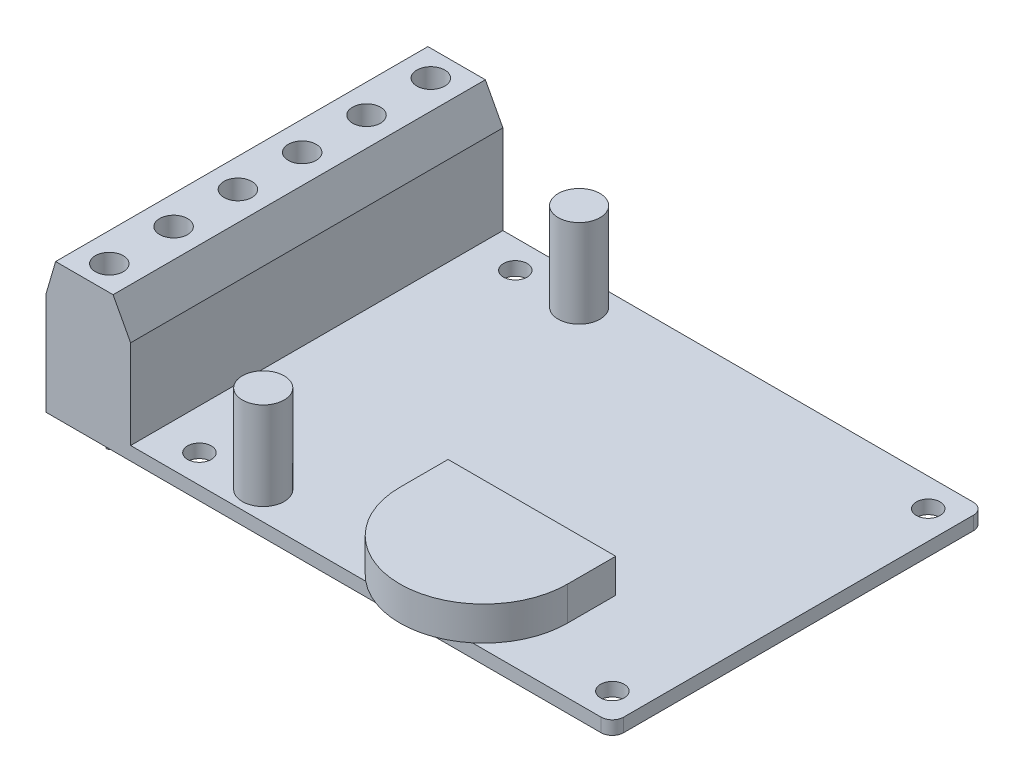
from build123d import *

# Parameters (mm, degrees)
EXTRUDE_1_DEPTH     = 1.2
EXTRUDE_3_DEPTH     = 33
SKETCH_4_R          = 1.237994263
CUT_EXTRUDE_1_DEPTH = 2
SKETCH_5_R          = 1.05
CUT_EXTRUDE_2_DEPTH = 2
SKETCH_6_R          = 0.435075244
EXTRUDE_4_DEPTH     = 0.1
SKETCH_7_R          = 0.221451087
EXTRUDE_5_DEPTH     = 2
SKETCH_8_W          = 0.314102564
SKETCH_8_H          = 2.557692308
EXTRUDE_6_DEPTH     = 0.01
EXTRUDE_8_DEPTH     = 3
SKETCH_10_R         = 1.85458941
EXTRUDE_7_DEPTH     = 7.8


with BuildPart() as part:
    # 草图2 → 凸台-拉伸1 (new body)
    with BuildSketch(Plane(origin=(0, 0, 0), x_dir=(1, 0, 0), z_dir=(0, 1, 0))):
        with BuildLine():
            Line((1, 0), (49.2, 0))
            ThreePointArc((49.2, 0), (49.907106781, -0.292893219), (50.2, -1))
            Line((50.2, -1), (50.2, -32))
            ThreePointArc((50.2, -32), (49.907106781, -32.707106781), (49.2, -33))
            Line((49.2, -33), (1, -33))
            ThreePointArc((1, -33), (0.292893219, -32.707106781), (0, -32))
            Line((0, -32), (0, -1))
            ThreePointArc((0, -1), (0.292893219, -0.292893219), (1, 0))
        make_face()
    extrude(amount=EXTRUDE_1_DEPTH)

    # 草图5 → 切除-拉伸2 (cut)
    with BuildSketch(Plane(origin=(0, 1.2, 0), x_dir=(1, 0, 0), z_dir=(0, 1, 0))):
        with Locations(Location((47.7, -2.5, 0), (0, 0, 270))):
            Circle(SKETCH_5_R)
        with Locations(Location((47.7, -30.5, 0), (0, 0, 270))):
            Circle(SKETCH_5_R)
        with Locations(Location((11.1, -2.5, 0), (0, 0, 270))):
            Circle(SKETCH_5_R)
        with Locations(Location((11.1, -30.5, 0), (0, 0, 270))):
            Circle(SKETCH_5_R)
    extrude(amount=-CUT_EXTRUDE_2_DEPTH, mode=Mode.SUBTRACT)



with BuildPart() as body_2:
    # 草图3 → 凸台-拉伸3 (new body)
    with BuildSketch(Plane.XY):
        Polygon((0, 0), (0, 9.08434782), (0.851677453, 12), (5.945874068, 12), (7.5, 9.08434782), (7.5, 0), align=None)
    extrude(amount=EXTRUDE_3_DEPTH)

    # 草图4 → 切除-拉伸1 (cut)
    with BuildSketch(Plane(origin=(0, 12, 0), x_dir=(1, 0, 0), z_dir=(0, 1, 0))):
        with Locations(Location((3.39877576, -2.288422337, 0), (0, 0, 270))):
            Circle(SKETCH_4_R)
        with Locations(Location((3.39877576, -7.988422337, 0), (0, 0, 270))):
            Circle(SKETCH_4_R)
        with Locations(Location((3.39877576, -13.688422337, 0), (0, 0, 270))):
            Circle(SKETCH_4_R)
        with Locations(Location((3.39877576, -19.388422337, 0), (0, 0, 270))):
            Circle(SKETCH_4_R)
        with Locations(Location((3.39877576, -25.088422337, 0), (0, 0, 270))):
            Circle(SKETCH_4_R)
        with Locations(Location((3.39877576, -30.788422337, 0), (0, 0, 270))):
            Circle(SKETCH_4_R)
    extrude(amount=-CUT_EXTRUDE_1_DEPTH, mode=Mode.SUBTRACT)


with BuildPart() as part_1:
    add(part.part)

    add(body_2.part)  # 凸台-拉伸4 merges body 2
    # 草图6 → 凸台-拉伸4 (add)
    with BuildSketch(Plane.XZ):
        with Locations(Location((3.39877576, 25.088422337, 0), (0, 0, 90))):
            Circle(SKETCH_6_R)
        with Locations(Location((3.39877576, 19.388422337, 0), (0, 0, 90))):
            Circle(SKETCH_6_R)
        with Locations(Location((3.39877576, 13.688422337, 0), (0, 0, 90))):
            Circle(SKETCH_6_R)
        with Locations(Location((3.39877576, 7.988422337, 0), (0, 0, 90))):
            Circle(SKETCH_6_R)
        with Locations(Location((3.39877576, 2.288422337, 0), (0, 0, 90))):
            Circle(SKETCH_6_R)
        with Locations(Location((3.39877576, 30.788422337, 0), (0, 0, 90))):
            Circle(SKETCH_6_R)
    extrude(amount=EXTRUDE_4_DEPTH)

    # 草图7 → 凸台-拉伸5 (add)
    with BuildSketch(Plane.XZ.offset(0.1)):
        with Locations(Location((3.39877576, 30.788422337, 0), (0, 0, 270))):
            Circle(SKETCH_7_R)
        with Locations(Location((3.39877576, 25.088422337, 0), (0, 0, 270))):
            Circle(SKETCH_7_R)
        with Locations(Location((3.39877576, 19.388422337, 0), (0, 0, 270))):
            Circle(SKETCH_7_R)
        with Locations(Location((3.39877576, 13.688422337, 0), (0, 0, 270))):
            Circle(SKETCH_7_R)
        with Locations(Location((3.39877576, 7.988422337, 0), (0, 0, 270))):
            Circle(SKETCH_7_R)
        with Locations(Location((3.39877576, 2.288422337, 0), (0, 0, 270))):
            Circle(SKETCH_7_R)
    extrude(amount=EXTRUDE_5_DEPTH)

    # 草图8 → 凸台-拉伸6 (add)
    # profile 1 of 6: a face of its own
    with BuildSketch(Plane.XZ):
        with BuildLine():
            Line((18.513026826, 20), (19.213447499, 20))
            add(Edge.make_bspline(
                [(19.213447499, 20), (19.260188628, 19.999844414), (19.349936772, 19.999545672), (19.478510043, 19.997879909), (19.59533714, 19.993105553), (19.700356979, 19.98899697), (19.793567634, 19.981505028), (19.875254925, 19.974344381), (19.945042622, 19.96497072), (19.987288473, 19.956265297), (20.006416249, 19.952323718)],
                knots=[0, 0, 0, 0, 1.410062039, 2.707475311, 3.878576406, 4.937260626, 5.877586885, 6.699081471, 7.410979367, 8, 8, 8, 8], degree=3))
            add(Edge.make_bspline(
                [(20.006416249, 19.952323718), (20.032022873, 19.945996953), (20.082689863, 19.933478389), (20.155639929, 19.907018788), (20.225154253, 19.876399163), (20.290944077, 19.840435443), (20.352679868, 19.798860663), (20.410998179, 19.752392541), (20.466163643, 19.701285335), (20.515945273, 19.644250494), (20.562884324, 19.584413984), (20.602472951, 19.519710227), (20.636599431, 19.4520487), (20.663769948, 19.380741282), (20.685647921, 19.30647951), (20.701074161, 19.228590713), (20.710325348, 19.147429738), (20.711267204, 19.09207183), (20.711744775, 19.064002404)],
                knots=[0, 0, 0, 0, 1.027469482, 2.033020251, 3.019912614, 3.986113645, 4.951240523, 5.91722682, 6.890402269, 7.87763091, 8.8651537, 9.85103654, 10.82876324, 11.815024772, 12.821070561, 13.842952187, 14.906261191, 16, 16, 16, 16], degree=3))
            add(Edge.make_bspline(
                [(20.711744775, 19.064002404), (20.710275777, 19.017367299), (20.707409381, 18.926370131), (20.680684277, 18.79430925), (20.636907758, 18.671119935), (20.576584469, 18.556957297), (20.499764993, 18.454046652), (20.407440202, 18.363656197), (20.29955859, 18.288016284), (20.199129274, 18.235563479), (20.110415075, 18.201970571), (20.037381762, 18.178334212), (19.957714784, 18.160072247), (19.87217745, 18.143712115), (19.780413794, 18.13136042), (19.682643755, 18.122313826), (19.578797603, 18.116659777), (19.507458534, 18.115817772), (19.470759198, 18.115384615)],
                knots=[0, 0, 0, 0, 1.260483769, 2.459530307, 3.627416485, 4.787058657, 5.939039949, 7.08810263, 8.267026773, 9.491475466, 10.141966685, 10.831826277, 11.566392101, 12.351337768, 13.187381173, 14.07005841, 15.007169909, 16, 16, 16, 16], degree=3))
            Line((19.470759198, 18.115384615), (20.75661657, 16.5))
            Line((20.75661657, 16.5), (20.368195095, 16.5))
            Line((20.368195095, 16.5), (19.082337724, 18.115384615))
            Line((19.082337724, 18.115384615), (18.82712939, 18.115384615))
            Line((18.82712939, 18.115384615), (18.82712939, 16.5))
            Line((18.82712939, 16.5), (18.513026826, 16.5))
            Line((18.513026826, 16.5), (18.513026826, 20))
        make_face()
        with BuildLine():
            Line((18.82712939, 19.641025641), (18.82712939, 18.474358974))
            Line((18.82712939, 18.474358974), (19.467954711, 18.469451122))
            add(Edge.make_bspline(
                [(19.467954711, 18.469451122), (19.49787475, 18.469437885), (19.555868307, 18.469412229), (19.639768972, 18.473406005), (19.717889083, 18.477949323), (19.789929836, 18.484898669), (19.855923411, 18.49385474), (19.915836824, 18.505057725), (19.969767876, 18.518109787), (20.032666414, 18.538311413), (20.102902946, 18.570317431), (20.179234406, 18.61688293), (20.244236743, 18.675452049), (20.299154606, 18.742425505), (20.343284037, 18.816061754), (20.374396092, 18.895478123), (20.394138534, 18.978669721), (20.396467079, 19.035847829), (20.397642211, 19.064703526)],
                knots=[0, 0, 0, 0, 1.146690395, 2.22261258, 3.21895312, 4.145990853, 4.996080663, 5.770904154, 6.481378293, 7.121626537, 8.300444488, 9.431385265, 10.535395872, 11.636531494, 12.74115979, 13.810798291, 14.895190096, 16, 16, 16, 16], degree=3))
            add(Edge.make_bspline(
                [(20.397642211, 19.064703526), (20.39644009, 19.092850099), (20.394057924, 19.148626338), (20.374609156, 19.230282248), (20.341719775, 19.307349198), (20.297397537, 19.379513683), (20.243398382, 19.445019419), (20.180080569, 19.501066572), (20.109175374, 19.547316037), (20.042904175, 19.576870418), (19.983669963, 19.594990271), (19.932240303, 19.607741435), (19.874128825, 19.617985904), (19.809053367, 19.626193964), (19.737291736, 19.633248909), (19.658481085, 19.638000687), (19.573144304, 19.640814551), (19.513997373, 19.64095364), (19.48337939, 19.641025641)],
                knots=[0, 0, 0, 0, 1.101028733, 2.181837193, 3.264309656, 4.369019818, 5.486613113, 6.575447106, 7.666700264, 8.788928104, 9.402425223, 10.0903467, 10.862060571, 11.710948788, 12.657782767, 13.684531032, 14.801375019, 16, 16, 16, 16], degree=3))
            Line((19.48337939, 19.641025641), (18.82712939, 19.641025641))
        make_face(mode=Mode.SUBTRACT)
    # profile 2 of 6: a face of its own
    with BuildSketch(Plane.XZ):
        with BuildLine():
            Line((21.339949903, 19.057692308), (21.654052467, 19.057692308))
            Line((21.654052467, 19.057692308), (21.654052467, 17.871394231))
            add(Edge.make_bspline(
                [(21.654052467, 17.871394231), (21.654194372, 17.836571482), (21.65446583, 17.769957194), (21.656306771, 17.674102007), (21.660636864, 17.586685294), (21.666050689, 17.507656557), (21.673012825, 17.437029166), (21.681296185, 17.375049809), (21.690554607, 17.321015625), (21.699617321, 17.288472269), (21.703832115, 17.27333734)],
                knots=[0, 0, 0, 0, 1.388932606, 2.656963016, 3.823490214, 4.879454478, 5.816252168, 6.653371382, 7.373723809, 8, 8, 8, 8], degree=3))
            add(Edge.make_bspline(
                [(21.703832115, 17.27333734), (21.71059357, 17.254314469), (21.723975911, 17.216664208), (21.748249395, 17.162275202), (21.778277731, 17.11189992), (21.811137559, 17.063595847), (21.849036967, 17.01879386), (21.891496438, 16.977569617), (21.937094675, 16.938365526), (22.004849698, 16.891980734), (22.097508964, 16.842265403), (22.219161719, 16.799369585), (22.351065945, 16.773733765), (22.442230665, 16.77075951), (22.489088525, 16.769230769)],
                knots=[0, 0, 0, 0, 0.725840625, 1.436591201, 2.137033971, 2.831655856, 3.53531722, 4.242432219, 4.957935707, 5.694543706, 7.190802206, 8.724350549, 10.316345118, 12, 12, 12, 12], degree=3))
            add(Edge.make_bspline(
                [(22.489088525, 16.769230769), (22.535942033, 16.770792018), (22.626594901, 16.773812745), (22.75704987, 16.798596284), (22.876301285, 16.840001973), (22.983152236, 16.897809384), (23.077118076, 16.968551447), (23.155422495, 17.051560256), (23.220029749, 17.144209643), (23.24823917, 17.213333922), (23.262425865, 17.248096955)],
                knots=[0, 0, 0, 0, 1.157059328, 2.238695713, 3.266970494, 4.264342957, 5.228770407, 6.160125903, 7.074715775, 8, 8, 8, 8], degree=3))
            add(Edge.make_bspline(
                [(23.262425865, 17.248096955), (23.266620095, 17.262063254), (23.275892513, 17.292939329), (23.285854865, 17.345319078), (23.294829326, 17.407783682), (23.302492502, 17.480741891), (23.307957665, 17.564003043), (23.310903692, 17.657541119), (23.314231967, 17.76106248), (23.314282483, 17.833530239), (23.314308878, 17.871394231)],
                knots=[0, 0, 0, 0, 0.557542046, 1.232589297, 2.036731608, 2.971723315, 4.038036528, 5.22795436, 6.551621927, 8, 8, 8, 8], degree=3))
            Line((23.314308878, 17.871394231), (23.314308878, 19.057692308))
            Line((23.314308878, 19.057692308), (23.628411442, 19.057692308))
            Line((23.628411442, 19.057692308), (23.628411442, 17.8125))
            add(Edge.make_bspline(
                [(23.628411442, 17.8125), (23.627969747, 17.770192829), (23.627112798, 17.688111129), (23.621605455, 17.568827017), (23.612155842, 17.457664772), (23.597813157, 17.354565552), (23.580947483, 17.259608071), (23.55919121, 17.172670625), (23.533212972, 17.094021071), (23.503907457, 17.022279294), (23.46928559, 16.9572324), (23.432458569, 16.895496583), (23.389933797, 16.838603648), (23.345163563, 16.783721511), (23.295361907, 16.733579983), (23.241462048, 16.687028507), (23.184222628, 16.643355476), (23.12237343, 16.604264196), (23.056817367, 16.569047551), (22.98747351, 16.537831473), (22.913492512, 16.513128896), (22.835828875, 16.49181823), (22.754102096, 16.475103761), (22.668390963, 16.463317194), (22.578724346, 16.456091863), (22.517614887, 16.455454818), (22.486284038, 16.455128205)],
                knots=[0, 0, 0, 0, 1.493040784, 2.896703357, 4.213163133, 5.428574705, 6.569057535, 7.615249723, 8.588095153, 9.490268104, 10.346124644, 11.18633936, 12.024365274, 12.850166724, 13.684164916, 14.514361689, 15.362232829, 16.222528818, 17.093394965, 17.986930858, 18.902426812, 19.842810585, 20.827885679, 21.843828298, 22.894529745, 24, 24, 24, 24], degree=3))
            add(Edge.make_bspline(
                [(22.486284038, 16.455128205), (22.455187524, 16.455467912), (22.394079979, 16.456135468), (22.304408734, 16.463277276), (22.218460128, 16.475085447), (22.13653973, 16.491940664), (22.058565332, 16.512979734), (21.984221092, 16.53798327), (21.914377529, 16.569063751), (21.848195525, 16.604041309), (21.786193137, 16.643606584), (21.728084559, 16.686974624), (21.673947707, 16.734080687), (21.623770639, 16.784728044), (21.578257662, 16.83954498), (21.53684162, 16.898090541), (21.498884915, 16.959784629), (21.464532125, 17.025847792), (21.435020369, 17.098419802), (21.408965123, 17.178716899), (21.387654485, 17.267619415), (21.370312017, 17.365051344), (21.356360576, 17.470546385), (21.346674434, 17.584714801), (21.341258603, 17.707278493), (21.340395542, 17.791928383), (21.339949903, 17.835637019)],
                knots=[0, 0, 0, 0, 1.083640291, 2.129454052, 3.13281866, 4.105697902, 5.042300162, 5.946461698, 6.836384745, 7.703652036, 8.553297018, 9.397182691, 10.228592656, 11.052265423, 11.879314572, 12.708807002, 13.549817954, 14.402308542, 15.300838682, 16.27712199, 17.341985831, 18.484375296, 19.725102775, 21.0496083, 22.476576903, 24, 24, 24, 24], degree=3))
            Line((21.339949903, 17.835637019), (21.339949903, 19.057692308))
        make_face()
    # profile 3 of 6: a face of its own
    with BuildSketch(Plane.XZ):
        with BuildLine():
            add(Edge.make_bspline(
                [(24.457137403, 20.134615385), (24.476628719, 20.133711232), (24.514796459, 20.131940728), (24.569989726, 20.116779251), (24.620246739, 20.091079566), (24.664824471, 20.056599885), (24.703076358, 20.016050441), (24.729857069, 19.968789473), (24.747069465, 19.917730834), (24.74914802, 19.882115745), (24.750206313, 19.863982372)],
                knots=[0, 0, 0, 0, 1.055194115, 2.066272739, 3.074728998, 4.095836921, 5.109056067, 6.073838105, 7.019297344, 8, 8, 8, 8], degree=3))
            add(Edge.make_bspline(
                [(24.750206313, 19.863982372), (24.749124154, 19.846319719), (24.746984852, 19.811402744), (24.729870363, 19.761229272), (24.702848126, 19.714624988), (24.664849, 19.674154278), (24.620240239, 19.639693658), (24.569991453, 19.613988919), (24.514796005, 19.598828782), (24.476628565, 19.597058093), (24.457137403, 19.596153846)],
                knots=[0, 0, 0, 0, 0.96129708, 1.900370562, 2.859976407, 3.87933698, 4.906634145, 5.921202961, 6.938410037, 8, 8, 8, 8], degree=3))
            add(Edge.make_bspline(
                [(24.457137403, 19.596153846), (24.437869128, 19.597023566), (24.400365948, 19.598716363), (24.345999106, 19.614286381), (24.296170616, 19.639702454), (24.251505943, 19.673928639), (24.21427575, 19.714873536), (24.187177425, 19.76120083), (24.170102463, 19.811409985), (24.167957834, 19.846322151), (24.16687298, 19.863982372)],
                knots=[0, 0, 0, 0, 1.054934014, 2.053291228, 3.073705704, 4.106921865, 5.123545215, 6.088680038, 7.033164197, 8, 8, 8, 8], degree=3))
            add(Edge.make_bspline(
                [(24.16687298, 19.863982372), (24.167934067, 19.882113221), (24.170018108, 19.917723354), (24.187190224, 19.968818387), (24.214050032, 20.015799889), (24.251530595, 20.056825388), (24.296164055, 20.091070823), (24.346000801, 20.116481804), (24.4003655, 20.132053144), (24.437868976, 20.133745758), (24.457137403, 20.134615385)],
                knots=[0, 0, 0, 0, 0.98631895, 1.937192651, 2.907499808, 3.917963147, 4.944918757, 5.95915025, 6.951458133, 8, 8, 8, 8], degree=3))
        make_face()
    # profile 4 of 6: a face of its own
    with BuildSketch(Plane.XZ):
        with Locations((24.458539647, 17.778846154)):
            Rectangle(SKETCH_8_W, SKETCH_8_H)
    # profile 5 of 6: a face of its own
    with BuildSketch(Plane.XZ):
        with BuildLine():
            Line((27.622001185, 19.057692308), (27.936103749, 19.057692308))
            Line((27.936103749, 19.057692308), (27.936103749, 17.027944712))
            add(Edge.make_bspline(
                [(27.936103749, 17.027944712), (27.935826707, 16.984707117), (27.935291948, 16.901248144), (27.931440977, 16.780569865), (27.923320299, 16.669103779), (27.914111618, 16.56634152), (27.900864902, 16.47275941), (27.884688534, 16.388078206), (27.866452855, 16.312216643), (27.850432638, 16.265491802), (27.842854551, 16.243389423)],
                knots=[0, 0, 0, 0, 1.307562039, 2.523909702, 3.650326591, 4.686913197, 5.643429486, 6.506965704, 7.293745905, 8, 8, 8, 8], degree=3))
            add(Edge.make_bspline(
                [(27.842854551, 16.243389423), (27.831665312, 16.214659501), (27.809621385, 16.158058664), (27.768335752, 16.077824344), (27.722101848, 16.002277954), (27.669295098, 15.931840503), (27.610154294, 15.86686559), (27.546072802, 15.805941591), (27.47580261, 15.750357423), (27.399383898, 15.701072126), (27.318578265, 15.656685072), (27.233432163, 15.618238505), (27.144425724, 15.584751661), (27.050722833, 15.559668865), (26.953792598, 15.537934145), (26.852495167, 15.523789459), (26.74742237, 15.514162401), (26.67597699, 15.513272168), (26.639729551, 15.512820513)],
                knots=[0, 0, 0, 0, 0.981931301, 1.934503488, 2.87077864, 3.801706999, 4.735015492, 5.667491629, 6.616593066, 7.585388521, 8.561939025, 9.551802639, 10.560317337, 11.588439944, 12.640189604, 13.723962949, 14.845264515, 16, 16, 16, 16], degree=3))
            add(Edge.make_bspline(
                [(26.639729551, 15.512820513), (26.586844816, 15.513676999), (26.483546721, 15.515349946), (26.332941728, 15.534840861), (26.189907008, 15.562395234), (26.056332551, 15.604100661), (25.933062455, 15.655137651), (25.820938579, 15.713732604), (25.720967472, 15.780921913), (25.630843799, 15.857422514), (25.549502208, 15.948386195), (25.472974918, 16.055585039), (25.399313977, 16.180651929), (25.356145339, 16.272444642), (25.333539647, 16.320512821)],
                knots=[0, 0, 0, 0, 1.157897085, 2.2616841, 3.32207898, 4.345638746, 5.321241055, 6.241986252, 7.112515963, 7.955008012, 8.825025602, 9.77857164, 10.836726669, 12, 12, 12, 12], degree=3))
            Line((25.333539647, 16.320512821), (25.647642211, 16.320512821))
            add(Edge.make_bspline(
                [(25.647642211, 16.320512821), (25.67290442, 16.280406945), (25.722288929, 16.202004896), (25.81463741, 16.10049174), (25.915843736, 16.013738376), (26.029323419, 15.943827602), (26.155548634, 15.89111781), (26.294595321, 15.853542514), (26.447594942, 15.831046247), (26.554113157, 15.828334953), (26.609581313, 15.826923077)],
                knots=[0, 0, 0, 0, 0.997731894, 1.950442991, 2.880492273, 3.800895997, 4.748200782, 5.754801363, 6.83083817, 8, 8, 8, 8], degree=3))
            add(Edge.make_bspline(
                [(26.609581313, 15.826923077), (26.664348204, 15.828353226), (26.769933286, 15.831110409), (26.921764455, 15.853552554), (27.060359394, 15.891125987), (27.184919594, 15.943734374), (27.293975363, 16.00818478), (27.387987354, 16.080184855), (27.46413203, 16.161365858), (27.515344997, 16.236147664), (27.547179614, 16.302771793), (27.567451851, 16.360124389), (27.583925821, 16.424977267), (27.597705658, 16.497113003), (27.609076572, 16.57663466), (27.616279454, 16.663724064), (27.621485265, 16.758183286), (27.621825235, 16.823676424), (27.622001185, 16.857572115)],
                knots=[0, 0, 0, 0, 1.570740765, 3.028230971, 4.391408896, 5.680370741, 6.894727393, 8.017376726, 9.065722033, 10.075533815, 10.603371122, 11.180248986, 11.817768598, 12.521299649, 13.286540596, 14.121245857, 15.027658897, 16, 16, 16, 16], degree=3))
            Line((27.622001185, 16.857572115), (27.622001185, 16.990084135))
            add(Edge.make_bspline(
                [(27.622001185, 16.990084135), (27.590120068, 16.952142332), (27.526918612, 16.876926113), (27.417771285, 16.778364476), (27.298554369, 16.693478346), (27.169470827, 16.623859711), (27.033682585, 16.568178287), (26.892660354, 16.529235326), (26.747668299, 16.504075426), (26.649416149, 16.50136811), (26.599765608, 16.5)],
                knots=[0, 0, 0, 0, 1.012485704, 2.007162095, 2.997754123, 3.998611389, 4.999708251, 5.992315798, 6.98544096, 8, 8, 8, 8], degree=3))
            add(Edge.make_bspline(
                [(26.599765608, 16.5), (26.570529339, 16.500515026), (26.512402781, 16.501538985), (26.426048034, 16.510497762), (26.340967596, 16.523496504), (26.257359892, 16.542577943), (26.175104279, 16.56706967), (26.094336687, 16.597686409), (26.01440316, 16.632301527), (25.936756663, 16.67307433), (25.862170532, 16.718436637), (25.791207347, 16.767575528), (25.724238808, 16.820233816), (25.661902318, 16.876930756), (25.604279647, 16.937584289), (25.550595779, 17.001547842), (25.501738432, 17.069714583), (25.456705042, 17.140841541), (25.417647492, 17.215402464), (25.38336312, 17.29178056), (25.353553715, 17.369812514), (25.329788313, 17.449759577), (25.3116372, 17.531571346), (25.298126973, 17.615113795), (25.290464041, 17.700644182), (25.289269117, 17.758265532), (25.288667852, 17.787259615)],
                knots=[0, 0, 0, 0, 1.028754217, 2.045334182, 3.052854819, 4.056607503, 5.061168794, 6.071104265, 7.095078842, 8.125279047, 9.155117945, 10.165957491, 11.161587969, 12.151493252, 13.128948131, 14.104219989, 15.088194871, 16.07871515, 17.064853787, 18.047899887, 19.02414258, 20.002704429, 20.980574569, 21.971845993, 22.979467364, 24, 24, 24, 24], degree=3))
            add(Edge.make_bspline(
                [(25.288667852, 17.787259615), (25.289187018, 17.816262711), (25.29022334, 17.87415657), (25.299174319, 17.960035956), (25.311942509, 18.044765391), (25.332150278, 18.127471533), (25.3564728, 18.209096284), (25.386596373, 18.289036741), (25.422815132, 18.36731725), (25.463824882, 18.443995781), (25.509908974, 18.518043396), (25.560441455, 18.588370042), (25.615483329, 18.654458214), (25.674275245, 18.716974636), (25.737535062, 18.775316129), (25.805230054, 18.829341094), (25.876692935, 18.87995512), (25.952145185, 18.926066457), (26.030422573, 18.966848704), (26.109536391, 19.004061301), (26.190534626, 19.03359542), (26.271907165, 19.059618519), (26.35508708, 19.078053715), (26.439054474, 19.092275957), (26.524096812, 19.100940678), (26.581049707, 19.102022263), (26.609581313, 19.102564103)],
                knots=[0, 0, 0, 0, 1.008818848, 2.013730394, 3.001654427, 3.987803273, 4.973046549, 5.963777569, 6.957074694, 7.972068341, 8.987420212, 9.989399531, 10.982630087, 11.977756091, 12.973280677, 13.973972381, 14.989194003, 16.018387222, 17.047741039, 18.059210846, 19.057554164, 20.045176975, 21.029480261, 22.018708529, 23.007435371, 24, 24, 24, 24], degree=3))
            add(Edge.make_bspline(
                [(26.609581313, 19.102564103), (26.656632252, 19.101207429), (26.7495434, 19.098528416), (26.886274402, 19.077507271), (27.018216642, 19.043993258), (27.146114658, 18.995977627), (27.271010309, 18.930427589), (27.392491964, 18.844084641), (27.510911098, 18.736174301), (27.583988929, 18.653421437), (27.622001185, 18.610376603)],
                knots=[0, 0, 0, 0, 0.96728863, 1.910097829, 2.838038873, 3.762875196, 4.71315279, 5.730631239, 6.819562287, 8, 8, 8, 8], degree=3))
            Line((27.622001185, 18.610376603), (27.622001185, 19.057692308))
        make_face()
        with BuildLine():
            add(Edge.make_bspline(
                [(26.634821698, 18.788461538), (26.588890994, 18.786900473), (26.49795794, 18.783809894), (26.364669597, 18.757425181), (26.235992664, 18.716079281), (26.114387236, 18.656936666), (26.000480126, 18.584842428), (25.899405305, 18.49750214), (25.811000389, 18.397755943), (25.736217451, 18.286505696), (25.676686084, 18.166483421), (25.634542665, 18.039972687), (25.607292642, 17.909017694), (25.60428499, 17.819645091), (25.602770416, 17.774639423)],
                knots=[0, 0, 0, 0, 1.026226791, 2.031711442, 3.026614839, 4.04107745, 5.047145931, 6.032893242, 7.017642609, 8.019221815, 9.021877557, 10.003543541, 10.994637589, 12, 12, 12, 12], degree=3))
            add(Edge.make_bspline(
                [(25.602770416, 17.774639423), (25.603496173, 17.740706151), (25.604923524, 17.673969327), (25.618647102, 17.576031432), (25.640828067, 17.482751118), (25.672265273, 17.394122744), (25.711217968, 17.309637949), (25.760210339, 17.229878714), (25.817861311, 17.154774008), (25.883719649, 17.084879326), (25.956296031, 17.021218358), (26.03501523, 16.965280317), (26.11977048, 16.919529596), (26.20847729, 16.879988759), (26.303288046, 16.851109691), (26.402837132, 16.829070912), (26.507828829, 16.816462154), (26.579400568, 16.814899356), (26.61589141, 16.814102564)],
                knots=[0, 0, 0, 0, 1.039728707, 2.044842319, 3.024901384, 3.974314358, 4.923051295, 5.871625912, 6.837440708, 7.820715446, 8.810779094, 9.792721783, 10.773906224, 11.758876063, 12.764959493, 13.806266761, 14.881525401, 16, 16, 16, 16], degree=3))
            add(Edge.make_bspline(
                [(26.61589141, 16.814102564), (26.652855168, 16.814870173), (26.725137405, 16.816371224), (26.830708342, 16.829274723), (26.930741082, 16.850096699), (27.025143904, 16.879659725), (27.114273245, 16.917381475), (27.19712786, 16.965118093), (27.275484308, 17.019482525), (27.346840718, 17.082894539), (27.411364883, 17.152779534), (27.46759565, 17.228824429), (27.515510099, 17.309884948), (27.555187769, 17.395951954), (27.585478973, 17.487694307), (27.605797878, 17.584882663), (27.620004623, 17.687051401), (27.621325548, 17.757060018), (27.622001185, 17.79286859)],
                knots=[0, 0, 0, 0, 1.121943988, 2.193949579, 3.223793937, 4.220241907, 5.192961521, 6.155822191, 7.11847367, 8.083710714, 9.04790392, 10.001595906, 10.949595423, 11.902125208, 12.873731292, 13.87582262, 14.913508608, 16, 16, 16, 16], degree=3))
            add(Edge.make_bspline(
                [(27.622001185, 17.79286859), (27.620661617, 17.839486444), (27.618044572, 17.930561349), (27.593347414, 18.063268117), (27.553527204, 18.18803679), (27.497680451, 18.304472766), (27.427698443, 18.411342316), (27.343407594, 18.506666161), (27.246261563, 18.590567017), (27.136539463, 18.660465211), (27.018492018, 18.716930645), (26.894970822, 18.759292417), (26.766159258, 18.783286732), (26.678852848, 18.786726675), (26.634821698, 18.788461538)],
                knots=[0, 0, 0, 0, 1.070913519, 2.092188694, 3.091357305, 4.074328408, 5.051968682, 6.018948707, 6.99050112, 7.9935919, 9.000589572, 9.992915277, 10.987769056, 12, 12, 12, 12], degree=3))
        make_face(mode=Mode.SUBTRACT)
    # profile 6 of 6: a face of its own
    with BuildSketch(Plane.XZ):
        with BuildLine():
            Line((30.753211121, 17.307692308), (31.032257595, 17.161157853))
            add(Edge.make_bspline(
                [(31.032257595, 17.161157853), (31.010021, 17.121714521), (30.966757392, 17.044973418), (30.892356644, 16.939541558), (30.814364571, 16.844693842), (30.729260603, 16.762964188), (30.639590924, 16.691712803), (30.54485827, 16.629374978), (30.444569452, 16.576256458), (30.338719727, 16.53150393), (30.226420176, 16.497094436), (30.107398659, 16.472790215), (29.981427164, 16.457766946), (29.895080984, 16.456021806), (29.850867371, 16.455128205)],
                knots=[0, 0, 0, 0, 1.120438281, 2.179929193, 3.190490725, 4.156257408, 5.095198341, 6.022838206, 6.959905092, 7.901321166, 8.864066838, 9.862729781, 10.905609505, 12, 12, 12, 12], degree=3))
            add(Edge.make_bspline(
                [(29.850867371, 16.455128205), (29.801725394, 16.45627538), (29.705863632, 16.458513187), (29.566323885, 16.477805652), (29.434944466, 16.50927801), (29.311732763, 16.553243552), (29.19699051, 16.610670876), (29.090489656, 16.680630358), (28.99167013, 16.762762612), (28.903645921, 16.857779056), (28.824402038, 16.959461013), (28.754476218, 17.065416898), (28.696018787, 17.175380122), (28.648466177, 17.288650646), (28.610061312, 17.40451454), (28.583294608, 17.524026007), (28.56786486, 17.646861592), (28.565500414, 17.729958927), (28.564308878, 17.771834936)],
                knots=[0, 0, 0, 0, 1.145258523, 2.234067595, 3.276747158, 4.290159414, 5.277019952, 6.260822364, 7.254936242, 8.264827045, 9.274100331, 10.257902744, 11.220704747, 12.172965371, 13.118907548, 14.062713208, 15.023725156, 16, 16, 16, 16], degree=3))
            add(Edge.make_bspline(
                [(28.564308878, 17.771834936), (28.565368019, 17.811129766), (28.567467097, 17.889006931), (28.580697885, 18.004272476), (28.604146178, 18.116300928), (28.636322502, 18.225185376), (28.677873748, 18.33074351), (28.728705967, 18.433039574), (28.788898345, 18.531964713), (28.835371018, 18.594367847), (28.858780031, 18.625801282)],
                knots=[0, 0, 0, 0, 1.024358464, 2.0301432, 3.019427413, 4.004406732, 4.986367066, 5.972626655, 6.978780325, 8, 8, 8, 8], degree=3))
            add(Edge.make_bspline(
                [(28.858780031, 18.625801282), (28.890487714, 18.663670152), (28.952898661, 18.738208303), (29.058455016, 18.836146628), (29.172755212, 18.918190404), (29.294366839, 18.98619754), (29.424703313, 19.037871187), (29.562012604, 19.076378769), (29.70785819, 19.09795678), (29.807563411, 19.101004614), (29.858579711, 19.102564103)],
                knots=[0, 0, 0, 0, 1.030682036, 2.02871468, 2.997146059, 3.962720338, 4.930598197, 5.918074684, 6.934738563, 8, 8, 8, 8], degree=3))
            add(Edge.make_bspline(
                [(29.858579711, 19.102564103), (29.911027316, 19.101210054), (30.013917562, 19.098553718), (30.163949683, 19.073927385), (30.3059104, 19.03487483), (30.439742904, 18.97972104), (30.565460765, 18.908561488), (30.682246814, 18.820419647), (30.792098327, 18.718001559), (30.856006906, 18.63923835), (30.888527628, 18.599158654)],
                knots=[0, 0, 0, 0, 1.056321875, 2.072262726, 3.055038591, 4.01806755, 4.982017516, 5.957941055, 6.960871419, 8, 8, 8, 8], degree=3))
            add(Edge.make_bspline(
                [(30.888527628, 18.599158654), (30.910654566, 18.568955072), (30.954761159, 18.508748954), (31.010008259, 18.410577797), (31.057965654, 18.307867202), (31.096298615, 18.198956905), (31.127338116, 18.085137325), (31.149794935, 17.96559478), (31.162964554, 17.840364869), (31.165553251, 17.755038314), (31.16687298, 17.711538462)],
                knots=[0, 0, 0, 0, 0.94817472, 1.890038105, 2.849395472, 3.817997239, 4.812318967, 5.836947057, 6.897266129, 8, 8, 8, 8], degree=3))
            Line((31.16687298, 17.711538462), (28.878411442, 17.711538462))
            add(Edge.make_bspline(
                [(28.878411442, 17.711538462), (28.879951048, 17.677837997), (28.882978622, 17.611567394), (28.897093765, 17.51459661), (28.919342539, 17.422223268), (28.950611602, 17.335140226), (28.988478447, 17.252210099), (29.034864164, 17.174048062), (29.090203718, 17.101010132), (29.151929417, 17.032442994), (29.220636512, 16.971382233), (29.29291926, 16.916730457), (29.369812825, 16.87092486), (29.450710908, 16.83374497), (29.535482693, 16.804638654), (29.624154888, 16.784770834), (29.716553005, 16.771463727), (29.779538739, 16.769984061), (29.811604551, 16.769230769)],
                knots=[0, 0, 0, 0, 1.094153842, 2.151609401, 3.174256925, 4.172055639, 5.149267565, 6.128595816, 7.11444997, 8.118368179, 9.117203808, 10.09244225, 11.054858984, 12.015122123, 12.976791628, 13.957293641, 14.960065497, 16, 16, 16, 16], degree=3))
            add(Edge.make_bspline(
                [(29.811604551, 16.769230769), (29.842955698, 16.769838826), (29.905162389, 16.771045327), (29.997803246, 16.782777238), (30.088942774, 16.801747513), (30.178203757, 16.827637504), (30.263774603, 16.859214356), (30.343020153, 16.897317213), (30.415900369, 16.93946696), (30.484017335, 16.987676635), (30.550088329, 17.046684822), (30.615630815, 17.120320543), (30.685907468, 17.207408071), (30.729897061, 17.272953737), (30.753211121, 17.307692308)],
                knots=[0, 0, 0, 0, 0.99110716, 1.966546729, 2.947904876, 3.932708344, 4.903319531, 5.828989031, 6.710028674, 7.56322171, 8.463672341, 9.504779593, 10.677557249, 12, 12, 12, 12], degree=3))
        make_face()
        with BuildLine():
            add(Edge.make_bspline(
                [(30.852770416, 18.025641026), (30.841273791, 18.067303899), (30.81914649, 18.14749152), (30.772910126, 18.25853241), (30.720838585, 18.357220311), (30.659216853, 18.442799944), (30.589398128, 18.518803457), (30.508752945, 18.585222043), (30.418317052, 18.644639494), (30.318557911, 18.694791993), (30.212916126, 18.737481852), (30.102309934, 18.766106968), (29.989452146, 18.78571651), (29.91311786, 18.787542618), (29.874705512, 18.788461538)],
                knots=[0, 0, 0, 0, 1.154881502, 2.222775134, 3.210006277, 4.132804581, 5.035138423, 5.962687519, 6.919655026, 7.923214229, 8.944639381, 9.960483929, 10.97369054, 12, 12, 12, 12], degree=3))
            add(Edge.make_bspline(
                [(29.874705512, 18.788461538), (29.843356074, 18.787849867), (29.781384825, 18.786640721), (29.690083756, 18.775170592), (29.602404057, 18.756210747), (29.51769877, 18.73024579), (29.437077901, 18.695637188), (29.358883133, 18.655053961), (29.285102737, 18.605512377), (29.238961442, 18.567753522), (29.215651025, 18.548677885)],
                knots=[0, 0, 0, 0, 1.04873581, 2.073130211, 3.073294108, 4.04793562, 5.032784715, 6.005352987, 6.992311501, 8, 8, 8, 8], degree=3))
            add(Edge.make_bspline(
                [(29.215651025, 18.548677885), (29.198957743, 18.533583569), (29.165174609, 18.503036353), (29.120034087, 18.450407146), (29.076813615, 18.393655584), (29.037479962, 18.33061046), (29.001402375, 18.261989681), (28.967642398, 18.188372045), (28.937255986, 18.109198915), (28.920159876, 18.054026476), (28.911364166, 18.025641026)],
                knots=[0, 0, 0, 0, 0.879870761, 1.780643979, 2.707998968, 3.669668524, 4.684282772, 5.740141944, 6.837334558, 8, 8, 8, 8], degree=3))
            Line((28.911364166, 18.025641026), (30.852770416, 18.025641026))
        make_face(mode=Mode.SUBTRACT)
    extrude(amount=EXTRUDE_6_DEPTH)

    # 草图11 → 凸台-拉伸8 (add)
    with BuildSketch(Plane(origin=(0, 1.2, 0), x_dir=(1, 0, 0), z_dir=(0, 1, 0))):
        with BuildLine():
            Line((25.64, -23), (40.5, -23))
            Line((40.5, -23), (40.5, -27.27))
            ThreePointArc((40.5, -27.27), (33.07, -34.7), (25.64, -27.27))
            Line((25.64, -27.27), (25.64, -23))
        make_face()
    extrude(amount=EXTRUDE_8_DEPTH)

    # 草图10 → 凸台-拉伸7 (add)
    with BuildSketch(Plane(origin=(0, 1.2, 0), x_dir=(1, 0, 0), z_dir=(0, 1, 0))):
        with Locations(Location((16.755343087, -2.5, 0), (0, 0, 270))):
            Circle(SKETCH_10_R)
        with Locations(Location((16.755343087, -30.5, 0), (0, 0, 90))):
            Circle(SKETCH_10_R)
    extrude(amount=EXTRUDE_7_DEPTH)


solid = part_1.part
